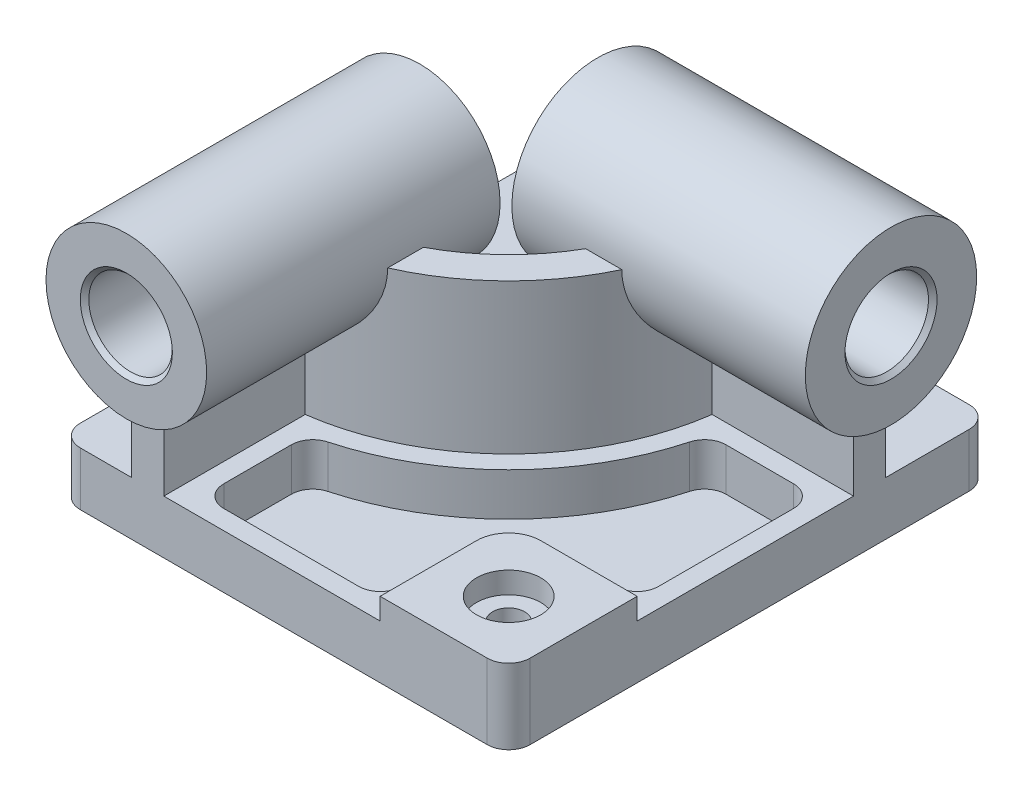
from build123d import *

# Parameters (mm, degrees)
BOSS_EXTRUDE1_DEPTH                     = 25
BOSS_EXTRUDE2_START                     = -25
BOSS_EXTRUDE2_DEPTH                     = 95
BOSS_EXTRUDE3_DEPTH                     = 10
CBORE_FOR_M8_HEX_HEAD_BOLT1_D           = 15
CBORE_FOR_M8_HEX_HEAD_BOLT1_CBORE_D     = 30
CBORE_FOR_M8_HEX_HEAD_BOLT1_CBORE_DEPTH = 10
CUT_EXTRUDE1_DEPTH                      = 20
BOSS_EXTRUDE4_START                     = 10
SKETCH7_R                               = 37.5
BOSS_EXTRUDE4_DEPTH                     = 137
BOSS_EXTRUDE5_START                     = 10
SKETCH8_R                               = 40
BOSS_EXTRUDE5_DEPTH                     = 137
CUT_EXTRUDE2_REACH                      = 330.704
SKETCH9_R                               = 19.5
CUT_EXTRUDE3_REACH                      = 320.152
SKETCH10_R                              = 19.5
CHAMFER1_SIZE                           = 2


with BuildPart() as part:
    # Sketch1 → Boss-Extrude1 (new body)
    with BuildSketch(Plane(origin=(0, 0, 0), x_dir=(1, 0, 0), z_dir=(0, 1, 0))):
        with BuildLine():
            Line((-24, 49), (166, 49))
            ThreePointArc((166, 49), (173.071067812, 46.071067812), (176, 39))
            Line((176, 39), (176, -166))
            ThreePointArc((176, -166), (173.071067812, -173.071067812), (166, -176))
            Line((166, -176), (-24, -176))
            ThreePointArc((-24, -176), (-31.071067812, -173.071067812), (-34, -166))
            Line((-34, -166), (-34, 39))
            ThreePointArc((-34, 39), (-31.071067812, 46.071067812), (-24, 49))
        make_face()
    extrude(amount=BOSS_EXTRUDE1_DEPTH)

    # Sketch2 → Boss-Extrude2 (add)
    with BuildSketch(Plane(origin=(0, 25, 0), x_dir=(1, 0, 0), z_dir=(0, 1, 0)).offset(BOSS_EXTRUDE2_START)):
        with BuildLine():
            Line((0, -96), (0, -176))
            Line((0, -176), (15, -176))
            Line((15, -176), (15, -109.981816679))
            ThreePointArc((15, -109.981816679), (78.488852712, -78.488852712), (109.981816679, -15))
            Line((109.981816679, -15), (176, -15))
            Line((176, -15), (176, 0))
            Line((176, 0), (96, 0))
            ThreePointArc((96, 0), (67.882250994, -67.882250994), (0, -96))
        make_face()
    extrude(amount=BOSS_EXTRUDE2_DEPTH)

    # Sketch3 → Boss-Extrude3 (add)
    with BuildSketch(Plane(origin=(0, 25, 0), x_dir=(1, 0, 0), z_dir=(0, 1, 0))):
        with BuildLine():
            Line((131, -116), (176, -116))
            Line((176, -116), (176, -166))
            ThreePointArc((176, -166), (173.071067812, -173.071067812), (166, -176))
            Line((166, -176), (116, -176))
            Line((116, -176), (116, -131))
            ThreePointArc((116, -131), (120.393398282, -120.393398282), (131, -116))
        make_face()
    extrude(amount=BOSS_EXTRUDE3_DEPTH)

    # CBORE for M8 Hex Head Bolt1 (through all)
    with Locations(Plane(origin=(0, 35, 0), x_dir=(1, 0, 0), z_dir=(0, 1, 0))):
        with Locations((146, -146)):
            CounterBoreHole(CBORE_FOR_M8_HEX_HEAD_BOLT1_D / 2, CBORE_FOR_M8_HEX_HEAD_BOLT1_CBORE_D / 2, CBORE_FOR_M8_HEX_HEAD_BOLT1_CBORE_DEPTH)

    # Sketch6 → Cut-Extrude1 (cut)
    with BuildSketch(Plane(origin=(0, 25, 0), x_dir=(1, 0, 0), z_dir=(0, 1, 0))):
        with BuildLine():
            Line((107, -157), (107, -131))
            ThreePointArc((107, -131), (114.029437252, -114.029437252), (131, -107))
            Line((131, -107), (157, -107))
            ThreePointArc((157, -107), (164.071067812, -104.071067812), (167, -97))
            Line((167, -97), (167, -34))
            ThreePointArc((167, -34), (164.071067812, -26.928932188), (157, -24))
            Line((157, -24), (125.475097131, -24))
            ThreePointArc((125.475097131, -24), (119.398660928, -26.057901847), (115.823166582, -31.384615385))
            ThreePointArc((115.823166582, -31.384615385), (84.852813742, -84.852813742), (31.384615385, -115.823166582))
            ThreePointArc((31.384615385, -115.823166582), (26.057901847, -119.398660928), (24, -125.475097131))
            Line((24, -125.475097131), (24, -157))
            ThreePointArc((24, -157), (26.928932188, -164.071067812), (34, -167))
            Line((34, -167), (97, -167))
            ThreePointArc((97, -167), (104.071067812, -164.071067812), (107, -157))
        make_face()
    extrude(amount=-CUT_EXTRUDE1_DEPTH, mode=Mode.SUBTRACT)

    # Sketch7 → Boss-Extrude4 (add)
    with BuildSketch(Plane.XY.offset(176).offset(BOSS_EXTRUDE4_START)):
        with Locations((7.5, 95)):
            Circle(SKETCH7_R)
    extrude(amount=-BOSS_EXTRUDE4_DEPTH)

    # Sketch8 → Boss-Extrude5 (add)
    with BuildSketch(Plane(origin=(176, 0, 0), x_dir=(0, 0, -1), z_dir=(1, 0, 0)).offset(BOSS_EXTRUDE5_START)):
        with Locations((-7.5, 95)):
            Circle(SKETCH8_R)
    extrude(amount=-BOSS_EXTRUDE5_DEPTH)

    # Sketch9 → Cut-Extrude2 (cut, up to next)
    with BuildSketch(Plane.XY.offset(186), mode=Mode.PRIVATE) as cut_extrude2_sk1:
        with Locations((7.5, 95)):
            Circle(SKETCH9_R)
    cut_extrude2_tool1 = extrude(cut_extrude2_sk1.sketch, amount=-CUT_EXTRUDE2_REACH, mode=Mode.PRIVATE) & part.part
    add(cut_extrude2_tool1.solids().sort_by_distance((7.5, 95, 186))[0], mode=Mode.SUBTRACT)

    # Sketch10 → Cut-Extrude3 (cut, up to next)
    with BuildSketch(Plane(origin=(186, 0, 0), x_dir=(0, 0, -1), z_dir=(1, 0, 0)), mode=Mode.PRIVATE) as cut_extrude3_sk1:
        with Locations((-7.5, 95)):
            Circle(SKETCH10_R)
    cut_extrude3_tool1 = extrude(cut_extrude3_sk1.sketch, amount=-CUT_EXTRUDE3_REACH, mode=Mode.PRIVATE) & part.part
    add(cut_extrude3_tool1.solids().sort_by_distance((186, 95, 7.5))[0], mode=Mode.SUBTRACT)

    # Chamfer1
    chamfer1_edges = [part.edges().sort_by_distance(p)[0] for p in [
        (-12, 95, 186),
        (-12, 95, 49),
        (186, 95, 27),
        (49, 95, 27),
    ]]
    chamfer(chamfer1_edges, length=CHAMFER1_SIZE)


solid = part.part
